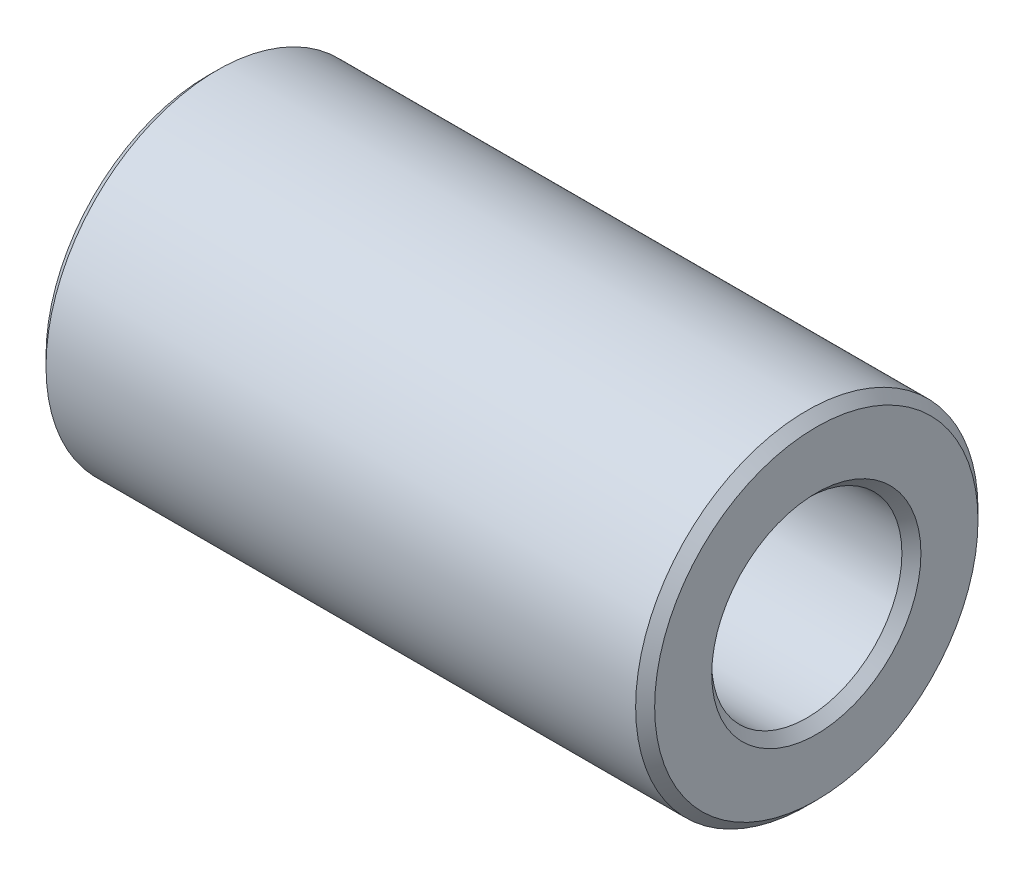
from build123d import *

# Parameters (mm, degrees)
ESQUISSE1_W     = 32
ESQUISSE1_H     = 4
CHANFREIN1_SIZE = 0.5


with BuildPart() as part:
    # Esquisse1 → Base-Révol.-Mince (revolve)
    with BuildSketch(Plane.XY, mode=Mode.PRIVATE) as base_r_vol_mince_sk:
        with Locations((0, 7)):
            Rectangle(ESQUISSE1_W, ESQUISSE1_H)
    revolve(base_r_vol_mince_sk.sketch.rotate(Axis((0, 0, 0), (1, 0, 0)), 90), axis=Axis((0, 0, 0), (1, 0, 0)))

    # Chanfrein1
    chanfrein1_edges = [part.edges().sort_by_distance(p)[0] for p in [
        (-16, 0, -9),
        (16, 0, -9),
        (16, 0, -5),
        (-16, 0, -5),
    ]]
    chamfer(chanfrein1_edges, length=CHANFREIN1_SIZE)


solid = part.part
